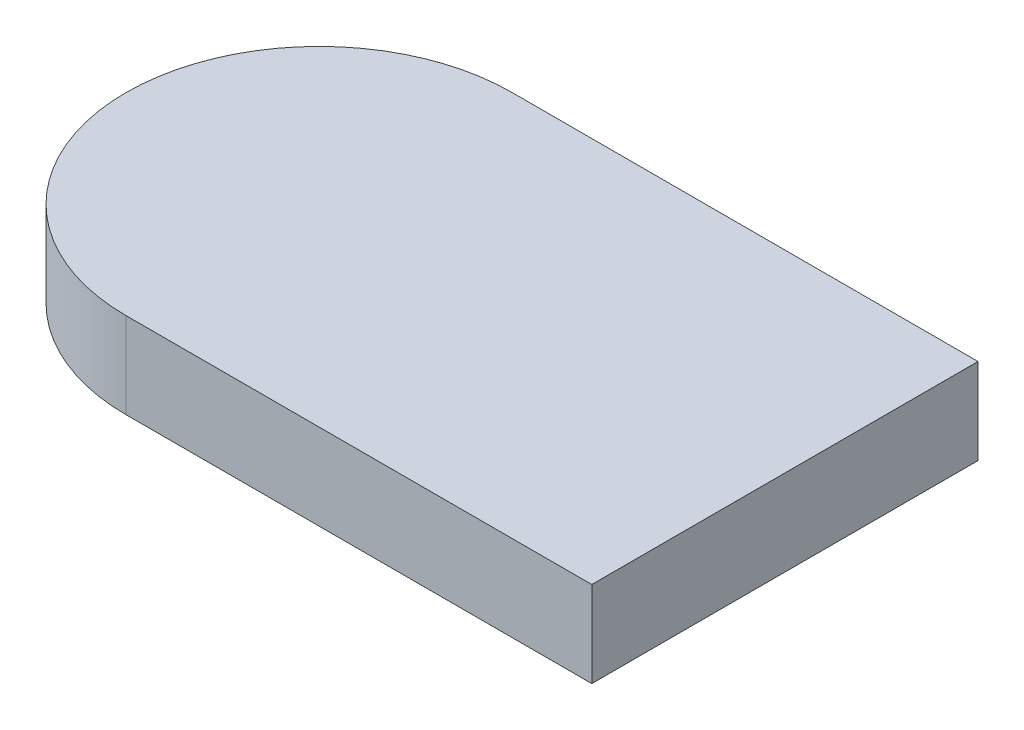
from build123d import *

# Parameters (mm, degrees)
BOSS_EXTRUDE1_DEPTH = 40


with BuildPart() as part:
    # Sketch1 → Boss-Extrude1 (new body)
    with BuildSketch(Plane(origin=(0, 0, 0), x_dir=(1, 0, 0), z_dir=(0, 1, 0))):
        with BuildLine():
            Line((0, 90), (217.08, 90))
            Line((217.08, 90), (217.08, -90))
            Line((217.08, -90), (0, -90))
            ThreePointArc((0, -90), (-90, 0), (0, 90))
        make_face()
    extrude(amount=BOSS_EXTRUDE1_DEPTH)


solid = part.part
